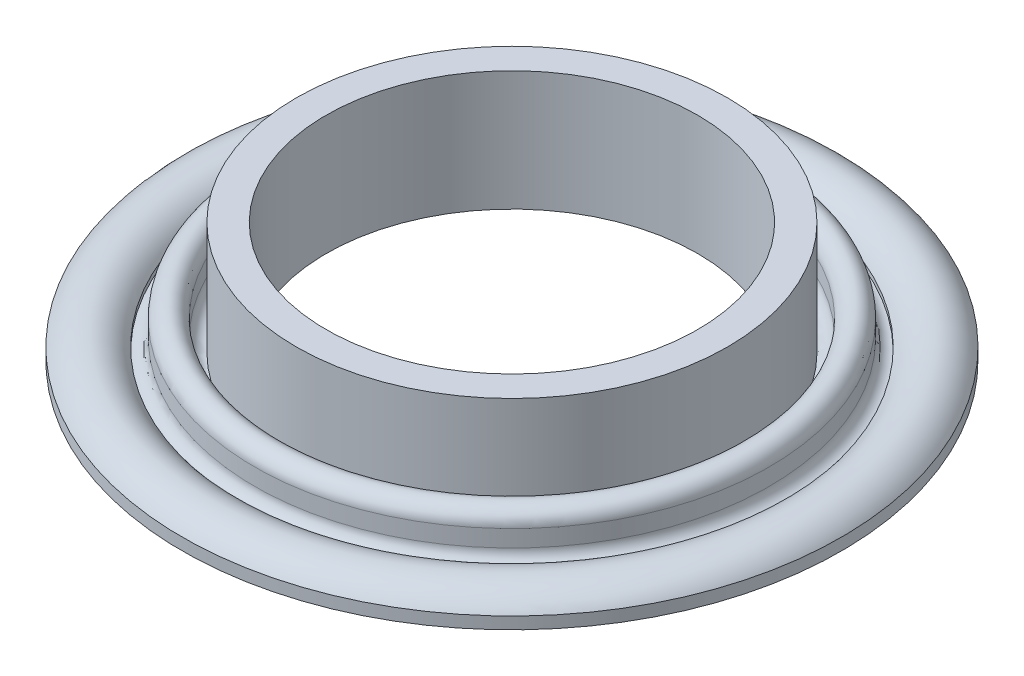
from build123d import *


with BuildPart() as part:
    # Sketch1 → Revolve1 (revolve)
    with BuildSketch(Plane.XY, mode=Mode.PRIVATE) as revolve1_sk:
        with BuildLine():
            Line((57.15, 0), (69.85, 0))
            Line((69.85, 0), (69.85, 2.54))
            ThreePointArc((69.85, 2.54), (63.5, 5.947886516), (57.15, 2.54))
            Line((57.15, 2.54), (57.15, 1.524))
            ThreePointArc((57.15, 1.524), (55.2796717, 2.298715348), (54.504956353, 4.169043647))
            Line((54.504956353, 4.169043647), (54.504956353, 7.734107611))
            ThreePointArc((54.504956353, 7.734107611), (51.435, 10.804063964), (48.365043647, 7.734107611))
            Line((48.365043647, 7.734107611), (48.365043647, 4.169043647))
            ThreePointArc((48.365043647, 4.169043647), (47.5903283, 2.298715348), (45.72, 1.524))
            Line((45.72, 1.524), (45.72, 25.4))
            Line((45.72, 25.4), (39.37, 25.4))
            Line((39.37, 25.4), (39.37, 0))
            Line((39.37, 0), (45.72, 0))
            ThreePointArc((45.72, 0), (48.667959034, 1.221084613), (49.889043647, 4.169043647))
            Line((49.889043647, 4.169043647), (49.889043647, 7.734107611))
            ThreePointArc((49.889043647, 7.734107611), (51.435, 9.280063964), (52.980956353, 7.734107611))
            Line((52.980956353, 7.734107611), (52.980956353, 4.169043647))
            ThreePointArc((52.980956353, 4.169043647), (54.202040966, 1.221084613), (57.15, 0))
        make_face()
    revolve(revolve1_sk.sketch.rotate(Axis((0, 0, 0), (0, 1, 0)), 90), axis=Axis((0, 0, 0), (0, 1, 0)))


solid = part.part
